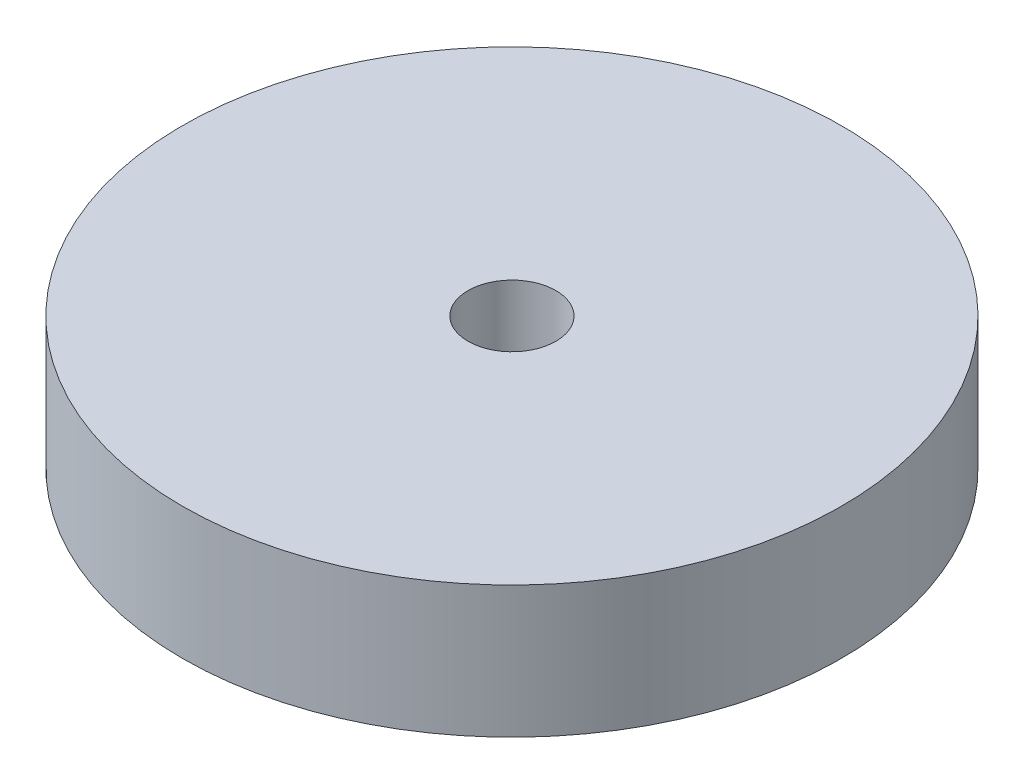
from build123d import *

# Parameters (mm, degrees)
SKETCH1_R           = 375
BOSS_EXTRUDE1_DEPTH = 150
SKETCH2_R           = 50
CUT_EXTRUDE1_DEPTH  = 75
SCALE1_SCALE        = 0.75


with BuildPart() as part:
    # Sketch1 → Boss-Extrude1 (new body)
    with BuildSketch(Plane(origin=(0, 0, 0), x_dir=(1, 0, 0), z_dir=(0, 1, 0))):
        with Locations(Location((0, 0, 0), (0, 0, 270))):
            Circle(SKETCH1_R)
    extrude(amount=BOSS_EXTRUDE1_DEPTH)

    # Sketch2 → Cut-Extrude1 (cut)
    with BuildSketch(Plane(origin=(0, 150, 0), x_dir=(1, 0, 0), z_dir=(0, 1, 0))):
        with Locations(Location((0, 0, 0), (0, 0, 270))):
            Circle(SKETCH2_R)
    extrude(amount=-CUT_EXTRUDE1_DEPTH, mode=Mode.SUBTRACT)


with BuildPart() as part_1:
    # Scale1: scaled about (0, 74.66367713, 0)
    add(part.part.scale(SCALE1_SCALE).moved(Location((0, 18.665919282, 0))))


solid = part_1.part
